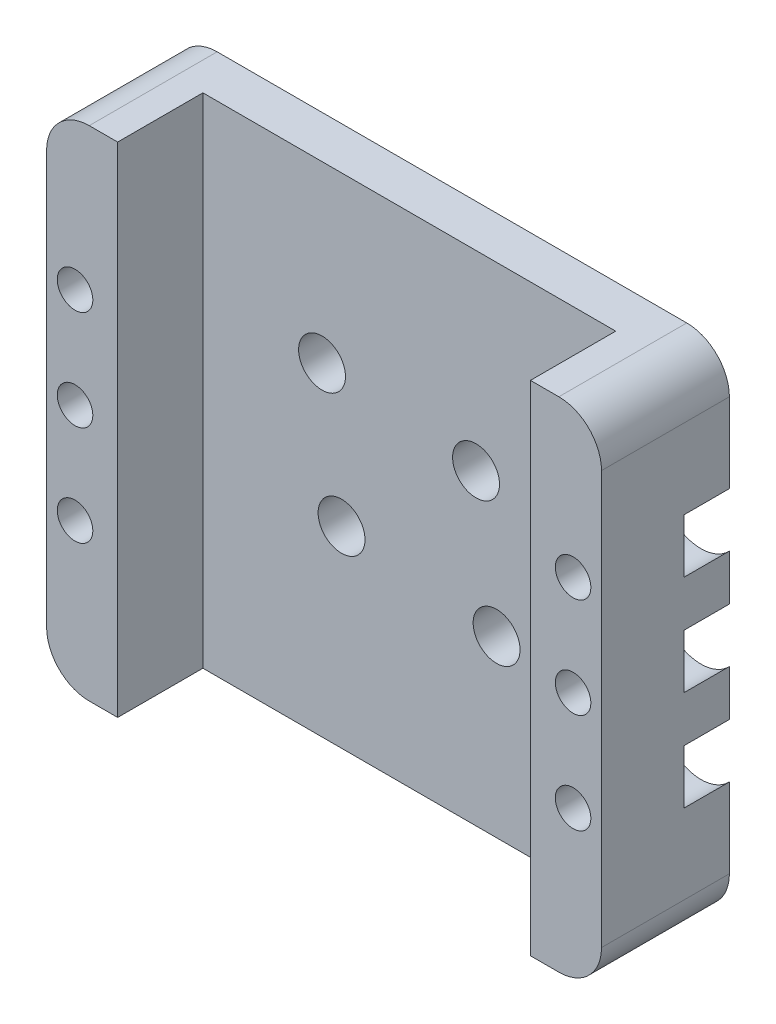
from build123d import *

# Parameters (mm, degrees)
SKETCH_1_W               = 39.05
SKETCH_1_H               = 35.07
SKETCH_1_R               = 1.65
SKETCH_1_R_2             = 1.25
EXTRUDE_1_DEPTH          = 3
EXTRUDE_2_DEPTH          = 1
EXTRUDE_2_DEPTH_BACK     = 9
SKETCH_2_W               = 5
SKETCH_2_H               = 35.07
CUT_EXTRUDE_3_DEPTH      = 41
CUT_EXTRUDE_3_DEPTH_BACK = 10
SKETCH_6_W               = 1
SKETCH_6_H               = 35.07
SKETCH_7_R               = 1.25
CUT_EXTRUDE_4_DEPTH      = 27
FILLET_6_R               = 3
FILLET_7_R               = 3
FILLET_8_R               = 3
SKETCH_13_R              = 2.76
CUT_EXTRUDE_7_DEPTH      = 3.2


with BuildPart() as part:
    # 草图1 → 凸台-拉伸1 (new body)
    with BuildSketch(Plane(origin=(0, 0, 0), x_dir=(-1, 0, 0), z_dir=(0, 0, 1))):
        with Locations((-56.669266884, 18.579160576)):
            Rectangle(SKETCH_1_W, SKETCH_1_H)
        with Locations(Location((-62.811349691, 23.836728616, 0), (0, 0, 180))):
            Circle(SKETCH_1_R, mode=Mode.SUBTRACT)
        with Locations(Location((-50.527184077, 13.321592536, 0), (0, 0, 180))):
            Circle(SKETCH_1_R, mode=Mode.SUBTRACT)
        with Locations(Location((-74.194266884, 25.614160576, 0), (0, 0, 180))):
            Circle(SKETCH_1_R_2, mode=Mode.SUBTRACT)
        with Locations(Location((-74.194266884, 11.544160576, 0), (0, 0, 180))):
            Circle(SKETCH_1_R_2, mode=Mode.SUBTRACT)
        with Locations(Location((-74.194266884, 18.579160576, 0), (0, 0, 180))):
            Circle(SKETCH_1_R_2, mode=Mode.SUBTRACT)
        with Locations(Location((-39.144266884, 25.614160576, 0), (0, 0, 180))):
            Circle(SKETCH_1_R_2, mode=Mode.SUBTRACT)
        with Locations(Location((-39.144266884, 18.579160576, 0), (0, 0, 180))):
            Circle(SKETCH_1_R_2, mode=Mode.SUBTRACT)
        with Locations(Location((-39.144266884, 11.544160576, 0), (0, 0, 180))):
            Circle(SKETCH_1_R_2, mode=Mode.SUBTRACT)
        with Locations(Location((-51.900012913, 22.58082967, 0), (0, 0, 180))):
            Circle(SKETCH_1_R, mode=Mode.SUBTRACT)
        with Locations(Location((-61.364857237, 14.469544513, 0), (0, 0, 180))):
            Circle(SKETCH_1_R, mode=Mode.SUBTRACT)
    extrude(amount=EXTRUDE_1_DEPTH)

    # 草图2 → 凸台-拉伸2 (add, two sides: drawn at the far end of the back side and taken through both)
    with BuildSketch(Plane(origin=(0, 0, 0), x_dir=(-1, 0, 0), z_dir=(0, 0, -1)).offset(-EXTRUDE_2_DEPTH_BACK)):
        with Locations((-73.694266884, -18.579160576)):
            Rectangle(SKETCH_2_W, SKETCH_2_H)
        with Locations((-39.644266884, -18.579160576)):
            Rectangle(SKETCH_2_W, SKETCH_2_H)
    extrude(amount=EXTRUDE_2_DEPTH + EXTRUDE_2_DEPTH_BACK)

    # 草图6 → 切除-拉伸3 (cut, two sides: drawn at the far end of the back side and taken through both)
    with BuildSketch(Plane(origin=(42.144266884, 0, 0), x_dir=(0, 0, -1), z_dir=(1, 0, 0)).offset(-CUT_EXTRUDE_3_DEPTH_BACK)):
        with Locations((0.5, -18.579160576)):
            Rectangle(SKETCH_6_W, SKETCH_6_H)
    extrude(amount=CUT_EXTRUDE_3_DEPTH + CUT_EXTRUDE_3_DEPTH_BACK, mode=Mode.SUBTRACT)

    # 草图7 → 切除-拉伸4 (cut)
    with BuildSketch(Plane(origin=(0, 0, 0), x_dir=(-1, 0, 0), z_dir=(0, 0, -1))):
        with Locations((-74.194266884, -11.544160576)):
            Circle(SKETCH_7_R)
        with Locations((-74.194266884, -18.579160576)):
            Circle(SKETCH_7_R)
        with Locations((-74.194266884, -25.614160576)):
            Circle(SKETCH_7_R)
        with Locations((-39.144266884, -11.544160576)):
            Circle(SKETCH_7_R)
        with Locations((-39.144266884, -18.579160576)):
            Circle(SKETCH_7_R)
        with Locations((-39.144266884, -25.614160576)):
            Circle(SKETCH_7_R)
    extrude(amount=-CUT_EXTRUDE_4_DEPTH, mode=Mode.SUBTRACT)

    # 圆角6
    fillet_6_edges = [part.edges().sort_by_distance(p)[0] for p in [
        (37.144266884, -36.114160576, 4.5),
    ]]
    fillet(fillet_6_edges, radius=FILLET_6_R)

    # 圆角7
    fillet_7_edges = [part.edges().sort_by_distance(p)[0] for p in [
        (37.144266884, -1.044160576, 4.5),
    ]]
    fillet(fillet_7_edges, radius=FILLET_7_R)

    # 圆角8
    fillet_8_edges = [part.edges().sort_by_distance(p)[0] for p in [
        (76.194266884, -1.044160576, 4.5),
        (76.194266884, -36.114160576, 4.5),
    ]]
    fillet(fillet_8_edges, radius=FILLET_8_R)

    # 草图13 → 切除-拉伸7 (cut)
    with BuildSketch(Plane(origin=(0, 0, 0), x_dir=(-1, 0, 0), z_dir=(0, 0, -1))):
        with Locations((-74.194266884, -11.544160576)):
            Circle(SKETCH_13_R)
        with Locations((-74.194266884, -18.579160576)):
            Circle(SKETCH_13_R)
        with Locations((-74.194266884, -25.614160576)):
            Circle(SKETCH_13_R)
        with Locations((-39.144266884, -11.544160576)):
            Circle(SKETCH_13_R)
        with Locations((-39.144266884, -18.579160576)):
            Circle(SKETCH_13_R)
        with Locations((-39.144266884, -25.614160576)):
            Circle(SKETCH_13_R)
    extrude(amount=-CUT_EXTRUDE_7_DEPTH, mode=Mode.SUBTRACT)


solid = part.part
